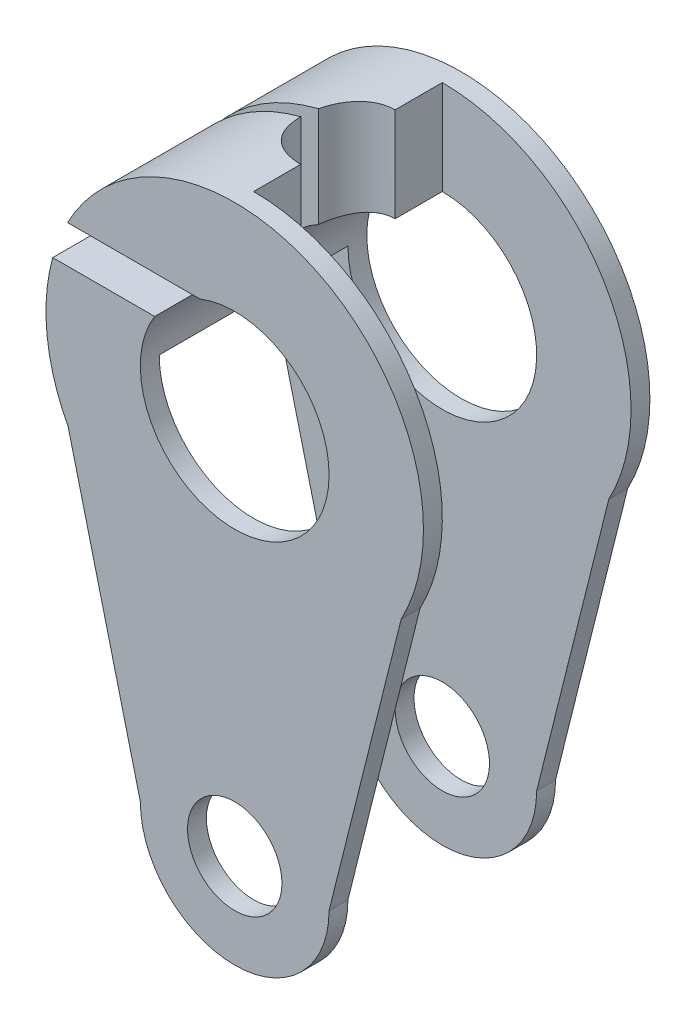
from build123d import *

# Parameters (mm, degrees)
CROQUIS1_R              = 3.175
CROQUIS1_R_2            = 1.5875
SALIENTE_EXTRUIR1_DEPTH = 3.81
CROQUIS2_W              = 12.70653568
CROQUIS2_H              = 6.35
CORTAR_EXTRUIR1_DEPTH   = 20.32
CROQUIS3_W              = 6.35
CROQUIS3_H              = 7.62
CORTAR_EXTRUIR2_DEPTH   = 20.32
CROQUIS4_W              = 3.81
CROQUIS4_H              = 1.27
CORTAR_EXTRUIR3_DEPTH   = 20.32
CROQUIS5_R              = 1.5875
CORTAR_EXTRUIR4_DEPTH   = 53.34
CORTAR_EXTRUIR6_DEPTH   = 53.34


with BuildPart() as part:
    # Croquis1 → Saliente-Extruir1 (new, symmetric)
    with BuildSketch(Plane.XY):
        with BuildLine():
            Line((-5.602941176, -2.988235294), (-3.175, -12.7))
            ThreePointArc((-3.175, -12.7), (0, -15.875), (3.175, -12.7))
            Line((3.175, -12.7), (5.602941176, -2.988235294))
            ThreePointArc((5.602941176, -2.988235294), (0, 6.35), (-5.602941176, -2.988235294))
        make_face()
        with Locations(Location((0, 0, 0), (0, 0, 180))):
            Circle(CROQUIS1_R, mode=Mode.SUBTRACT)
        with Locations(Location((0, -12.7, 0), (0, 0, 180))):
            Circle(CROQUIS1_R_2, mode=Mode.SUBTRACT)
    extrude(amount=SALIENTE_EXTRUIR1_DEPTH, both=True)

    # Croquis2 → Cortar-Extruir1 (cut)
    with BuildSketch(Plane(origin=(0, 0, 0), x_dir=(1, 0, 0), z_dir=(0, 1, 0))):
        with Locations((0.00326784, 0)):
            Rectangle(CROQUIS2_W, CROQUIS2_H)
    extrude(amount=-CORTAR_EXTRUIR1_DEPTH, mode=Mode.SUBTRACT)

    # Croquis3 → Cortar-Extruir2 (cut)
    with BuildSketch(Plane(origin=(0, 0, 0), x_dir=(0, 0, -1), z_dir=(1, 0, 0))):
        with Locations((0, 3.81)):
            Rectangle(CROQUIS3_W, CROQUIS3_H)
    extrude(amount=CORTAR_EXTRUIR2_DEPTH, mode=Mode.SUBTRACT)

    # Croquis4 → Cortar-Extruir3 (cut)
    with BuildSketch(Plane(origin=(0, 0, 0), x_dir=(0, 0, -1), z_dir=(1, 0, 0))):
        with Locations((-1.905, 2.315882353)):
            Rectangle(CROQUIS4_W, CROQUIS4_H)
    extrude(amount=-CORTAR_EXTRUIR3_DEPTH, mode=Mode.SUBTRACT)

    # Croquis5 → Cortar-Extruir4 (cut)
    with BuildSketch(Plane(origin=(0, 0, 0), x_dir=(1, 0, 0), z_dir=(0, 1, 0))):
        Circle(CROQUIS5_R)
    extrude(amount=CORTAR_EXTRUIR4_DEPTH, mode=Mode.SUBTRACT)

    # Croquis6 → Cortar-Extruir6 (cut)
    with BuildSketch(Plane(origin=(0, 0, 0), x_dir=(1, 0, 0), z_dir=(0, 1, 0))):
        Polygon((0, 0), (-5.622703384, 0), (-6.123490387, 0), (-6.123490387, 0.508), (0, 0.508), align=None)
    extrude(amount=CORTAR_EXTRUIR6_DEPTH, mode=Mode.SUBTRACT)


solid = part.part
